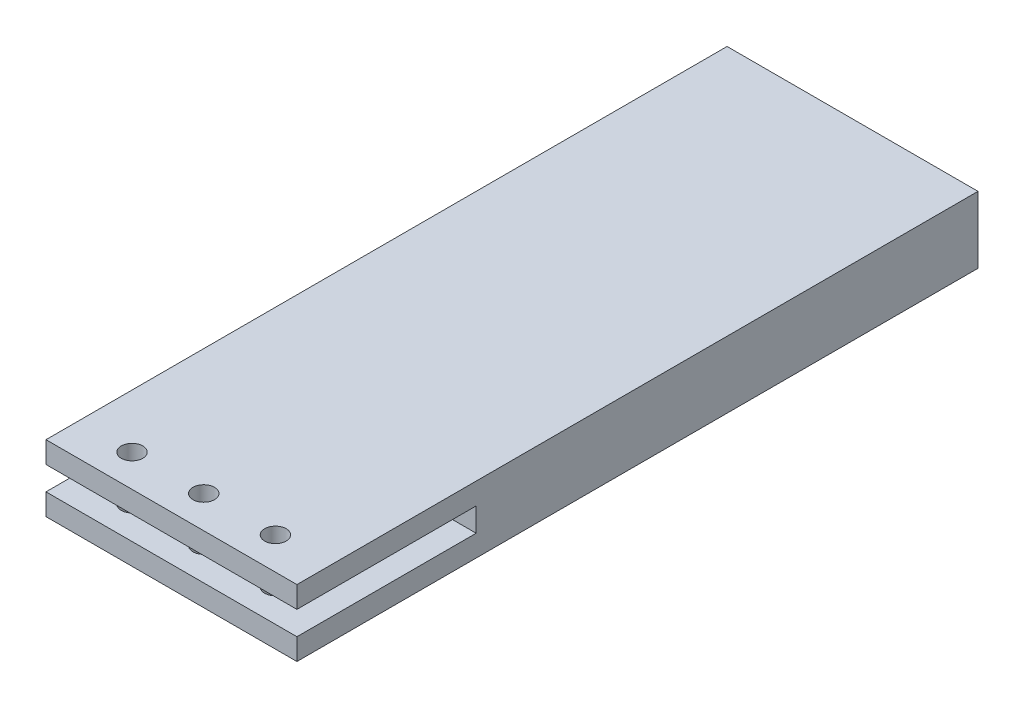
from build123d import *

# Parameters (mm, degrees)
SKETCH_1_W          = 35
SKETCH_1_H          = 3
EXTRUDE_1_DEPTH     = 25
EXTRUDE_1_2_DEPTH   = 25
SKETCH_2_W          = 35
SKETCH_2_H          = 9.3
EXTRUDE_2_DEPTH     = 70
SKETCH_3_R          = 1.5
CUT_EXTRUDE_1_DEPTH = 10


with BuildPart() as part:
    # 草图1 → 凸台-拉伸1 (new body)
    with BuildSketch(Plane.XY):
        with Locations((17.5, 1.5)):
            Rectangle(SKETCH_1_W, SKETCH_1_H)
    extrude(amount=EXTRUDE_1_DEPTH)



with BuildPart() as body_2:
    # 草图1 → Extrude 1 2 (new body)
    with BuildSketch(Plane.XY):
        with Locations((17.5, -4.8)):
            Rectangle(SKETCH_1_W, SKETCH_1_H)
    extrude(amount=EXTRUDE_1_2_DEPTH)


with BuildPart() as part_1:
    add(part.part)

    add(body_2.part)  # 凸台-拉伸2 merges body 2
    # 草图2 → 凸台-拉伸2 (add)
    with BuildSketch(Plane(origin=(0, 0, 0), x_dir=(-1, 0, 0), z_dir=(0, 0, -1))):
        with Locations((-17.5, -1.65)):
            Rectangle(SKETCH_2_W, SKETCH_2_H)
    extrude(amount=EXTRUDE_2_DEPTH)

    # 草图3 → 切除-拉伸1 (cut)
    with BuildSketch(Plane(origin=(0, 3, 0), x_dir=(1, 0, 0), z_dir=(0, 1, 0))):
        with Locations(Location((7.5, -20.5, 0), (0, 0, 270))):
            Circle(SKETCH_3_R)
        with Locations(Location((17.5, -20.5, 0), (0, 0, 270))):
            Circle(SKETCH_3_R)
        with Locations(Location((27.5, -20.5, 0), (0, 0, 270))):
            Circle(SKETCH_3_R)
    extrude(amount=-CUT_EXTRUDE_1_DEPTH, mode=Mode.SUBTRACT)


solid = part_1.part
